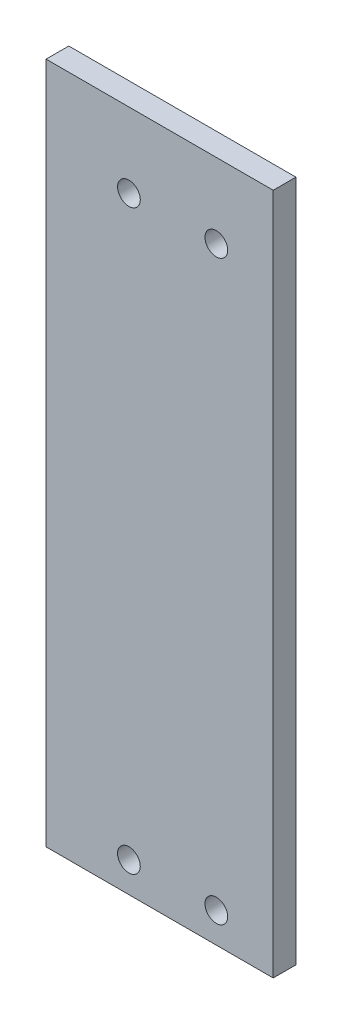
from build123d import *

# Parameters (mm, degrees)
SKETCH2_W           = 50
SKETCH2_H           = 150.188218987
SKETCH2_R           = 2.5
BOSS_EXTRUDE1_DEPTH = 5


with BuildPart() as part:
    # Sketch2 → Boss-Extrude1 (new body)
    with BuildSketch(Plane.XY):
        with Locations((10.732942453, 75.094109493)):
            Rectangle(SKETCH2_W, SKETCH2_H)
        with Locations((23.211000936, 6.647343634)):
            Circle(SKETCH2_R, mode=Mode.SUBTRACT)
        with Locations((3.968400349, 6.647343634)):
            Circle(SKETCH2_R, mode=Mode.SUBTRACT)
        with Locations(Location((3.968400349, 133.72909434, 0), (0, 0, 180))):
            Circle(SKETCH2_R, mode=Mode.SUBTRACT)
        with Locations(Location((23.211000936, 133.72909434, 0), (0, 0, 180))):
            Circle(SKETCH2_R, mode=Mode.SUBTRACT)
    extrude(amount=BOSS_EXTRUDE1_DEPTH)


solid = part.part
